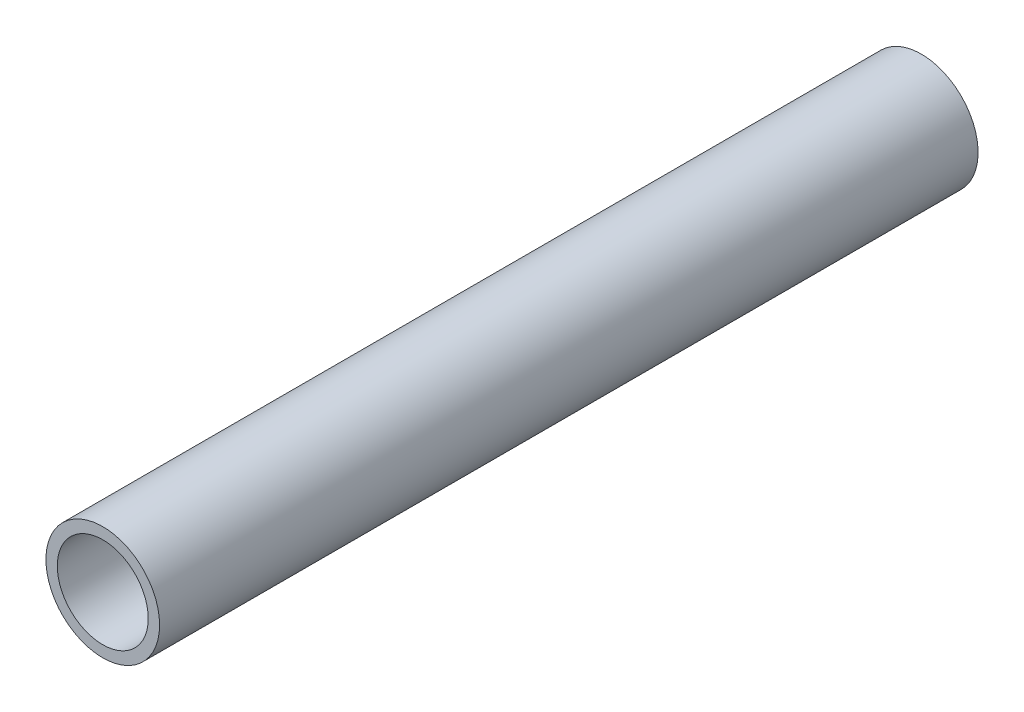
from build123d import *

# Parameters (mm, degrees)
ESBO_O1_R                  = 12.5
ESBO_O1_R_2                = 10
RESSALTO_EXTRUS_O1_DEPTH   = 180
CORTE_EXTRUS_O1_DEPTH      = 5
CORTE_EXTRUS_O1_DEPTH_BACK = 5
ESBO_O2_R                  = 12.5
ESBO_O2_R_2                = 12


with BuildPart() as part:
    # Esboço1 → Ressalto-extrusão1 (new body)
    with BuildSketch(Plane.XY):
        Circle(ESBO_O1_R)
        Circle(ESBO_O1_R_2, mode=Mode.SUBTRACT)
    extrude(amount=RESSALTO_EXTRUS_O1_DEPTH)

    # Esboço2 → Corte-extrusão1 (cut, two sides: drawn at the far end of the back side and taken through both)
    with BuildSketch(Plane(origin=(0, 0, 0), x_dir=(0, 0, -1), z_dir=(1, 0, 0)).offset(-CORTE_EXTRUS_O1_DEPTH_BACK)):
        with Locations((5, 0)):
            Circle(ESBO_O2_R)
        with Locations((5, 0)):
            Circle(ESBO_O2_R_2, mode=Mode.SUBTRACT)
    extrude(amount=CORTE_EXTRUS_O1_DEPTH + CORTE_EXTRUS_O1_DEPTH_BACK, mode=Mode.SUBTRACT)


solid = part.part
